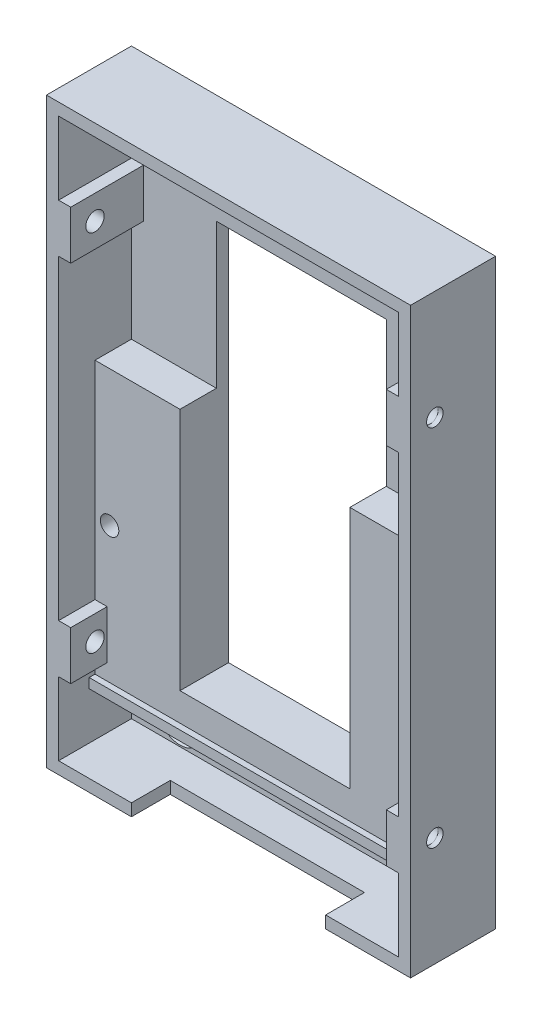
from build123d import *

# Parameters (mm, degrees)
SKICA1_W                                          = 75
SKICA1_H                                          = 120
SKICA1_W_2                                        = 35
SKICA1_H_2                                        = 80
P_IDAT_VYSUNUT_M1_DEPTH                           = 2.5
SKICA2_W                                          = 75
SKICA2_H                                          = 120
SKICA2_W_2                                        = 70
SKICA2_H_2                                        = 115
P_IDAT_VYSUNUT_M2_DEPTH                           = 15
KU_ELOV_ZAHLOUBEN_PRO_M4_ROUBU_SE_2_COUNT         = 2
KU_ELOV_ZAHLOUBEN_PRO_M4_ROUBU_SE_2_PITCH         = 50
KU_ELOV_ZAHLOUBEN_PRO_M4_ROUBU_SE_3_COUNT         = 2
KU_ELOV_ZAHLOUBEN_PRO_M4_ROUBU_SE_3_PITCH         = 105
KU_ELOV_ZAHLOUBEN_PRO_M4_ROUBU_SE_4_COUNT         = 2
KU_ELOV_ZAHLOUBEN_PRO_M4_ROUBU_SE_4_PITCH         = 116.297033496
ODEBRAT_VYSUNUT_M4_DEPTH                          = 10
P_IDAT_VYSUNUT_M3_DEPTH                           = 7.5
SKICA22_W                                         = 70
SKICA22_H                                         = 2
P_IDAT_VYSUNUT_M4_DEPTH                           = 1.2
D_RY_PRO_KOL_K_VELIKOST_MM1_D                     = 3.8
D_RY_PRO_KOL_K_VELIKOST_MM1_DEPTH                 = 7.5
D_RY_PRO_KOL_K_VELIKOST_MM1_TIP                   = 1.141635176
SKICA27_W                                         = 2.5
SKICA27_H                                         = 10
P_IDAT_VYSUNUT_M5_DEPTH                           = 15
V_LCOV_ZAHLOUBEN_PRO_M3_ROUBY_S_K_NIC_D           = 3.4
V_LCOV_ZAHLOUBEN_PRO_M3_ROUBY_S_K_NIC_DEPTH       = 5
V_LCOV_ZAHLOUBEN_PRO_M3_ROUBY_S_K_NIC_CBORE_D     = 3.8
V_LCOV_ZAHLOUBEN_PRO_M3_ROUBY_S_K_NIC_CBORE_DEPTH = 4


with BuildPart() as part:
    # Skica1 → Přidat vysunutím1 (new body)
    with BuildSketch(Plane.XY):
        Rectangle(SKICA1_W, SKICA1_H)
        Rectangle(SKICA1_W_2, SKICA1_H_2, mode=Mode.SUBTRACT)
    extrude(amount=P_IDAT_VYSUNUT_M1_DEPTH)

    # Skica2 → Přidat vysunutím2 (add)
    with BuildSketch(Plane.XY.offset(2.5)):
        Rectangle(SKICA2_W, SKICA2_H)
        Rectangle(SKICA2_W_2, SKICA2_H_2, mode=Mode.SUBTRACT)
    extrude(amount=P_IDAT_VYSUNUT_M2_DEPTH)

    # Skica15 → Kuželové zahloubení pro M4 šroubu se zápustnou hlavou plochou2 (revolve, cut)
    with BuildSketch(Plane(origin=(25, 52.5, 2.5), x_dir=(0, -1, 0), z_dir=(1, 0, 0))):
        Polygon((0, 0), (0, 2.5), (2.25, 2.5), (2.25, 2.45), (4.7, 0), align=None)
    ku_elov_zahlouben_pro_m4_roubu_se_z_p = revolve(axis=Axis((25, 52.5, 8.85), (0, 0, -1)), mode=Mode.SUBTRACT)

    # Ku_elov_ zahlouben_ pro M4 _roubu se 2: Kuželové zahloubení pro M4 šroubu se zápustnou hlavou plochou2 ×2
    with Locations(*[(-i * KU_ELOV_ZAHLOUBEN_PRO_M4_ROUBU_SE_2_PITCH, 0, 0) for i in range(1, KU_ELOV_ZAHLOUBEN_PRO_M4_ROUBU_SE_2_COUNT)]):
        add(ku_elov_zahlouben_pro_m4_roubu_se_z_p, mode=Mode.SUBTRACT)

    # Ku_elov_ zahlouben_ pro M4 _roubu se 3: Kuželové zahloubení pro M4 šroubu se zápustnou hlavou plochou2 ×2
    with Locations(*[(0, -i * KU_ELOV_ZAHLOUBEN_PRO_M4_ROUBU_SE_3_PITCH, 0) for i in range(1, KU_ELOV_ZAHLOUBEN_PRO_M4_ROUBU_SE_3_COUNT)]):
        add(ku_elov_zahlouben_pro_m4_roubu_se_z_p, mode=Mode.SUBTRACT)

    # Ku_elov_ zahlouben_ pro M4 _roubu se 4: Kuželové zahloubení pro M4 šroubu se zápustnou hlavou plochou2 ×2
    with Locations(*[Vector(-0.42993358039234786, -0.9028605188239304, 0) * (i * KU_ELOV_ZAHLOUBEN_PRO_M4_ROUBU_SE_4_PITCH) for i in range(1, KU_ELOV_ZAHLOUBEN_PRO_M4_ROUBU_SE_4_COUNT)]):
        add(ku_elov_zahlouben_pro_m4_roubu_se_z_p, mode=Mode.SUBTRACT)

    # Skica20 → Odebrat vysunutím4 (cut)
    with BuildSketch(Plane.XZ.offset(60)):
        Polygon((0, 9.5), (-20, 9.5), (-20, 17.5), (20, 17.5), (20, 9.5), align=None)
    extrude(amount=-ODEBRAT_VYSUNUT_M4_DEPTH, mode=Mode.SUBTRACT)

    # Skica21 → Přidat vysunutím3 (add)
    with BuildSketch(Plane.XY.offset(2.5)):
        Polygon((35, -47.8), (-35, -47.8), (-35, 10.2), (-17.5, 10.2), (-17.5, -40), (17.5, -40), (17.5, 10.2), (35, 10.2), align=None)
    extrude(amount=P_IDAT_VYSUNUT_M3_DEPTH)

    # Skica22 → Přidat vysunutím4 (add)
    with BuildSketch(Plane.XY.offset(10)):
        with Locations((0, -46.8)):
            Rectangle(SKICA22_W, SKICA22_H)
    extrude(amount=P_IDAT_VYSUNUT_M4_DEPTH)

    # Díry pro kolík, velikost mm1
    with Locations(Plane.XY.offset(10)):
        with Locations((32, -17.8), (-32, -17.8)):
            Hole(D_RY_PRO_KOL_K_VELIKOST_MM1_D / 2, depth=D_RY_PRO_KOL_K_VELIKOST_MM1_DEPTH)
            with Locations((0, 0, -(D_RY_PRO_KOL_K_VELIKOST_MM1_DEPTH + D_RY_PRO_KOL_K_VELIKOST_MM1_TIP / 2))):  # 118° drill point
                Cone(0, D_RY_PRO_KOL_K_VELIKOST_MM1_D / 2, D_RY_PRO_KOL_K_VELIKOST_MM1_TIP, mode=Mode.SUBTRACT)

    # Skica27 → Přidat vysunutím5 (add)
    with BuildSketch(Plane.XY.offset(2.5)):
        with Locations((33.75, 37.5)):
            Rectangle(SKICA27_W, SKICA27_H)
        with Locations((-33.75, 37.5)):
            Rectangle(SKICA27_W, SKICA27_H)
    p_idat_vysunut_m5 = extrude(amount=P_IDAT_VYSUNUT_M5_DEPTH)

    # Zrcadlit1: Přidat vysunutím5 across plane
    add(p_idat_vysunut_m5.mirror(Plane.ZX))

    # Válcové zahloubení pro M3 šrouby s kónickou hlavou1
    with Locations(Plane(origin=(-32.5, 0, 0), x_dir=(0, 0, -1), z_dir=(1, 0, 0))):
        with Locations((-12.5, -37.5), (-12.5, 37.5)):
            v_lcov_zahlouben_pro_m3_rouby_s_k_nic = CounterBoreHole(V_LCOV_ZAHLOUBEN_PRO_M3_ROUBY_S_K_NIC_D / 2, V_LCOV_ZAHLOUBEN_PRO_M3_ROUBY_S_K_NIC_CBORE_D / 2, V_LCOV_ZAHLOUBEN_PRO_M3_ROUBY_S_K_NIC_CBORE_DEPTH, depth=V_LCOV_ZAHLOUBEN_PRO_M3_ROUBY_S_K_NIC_DEPTH)

    # Zrcadlit2: Válcové zahloubení pro M3 šrouby s kónickou hlavou1 across plane
    add(v_lcov_zahlouben_pro_m3_rouby_s_k_nic.mirror(Plane(origin=(0, 0, 0), x_dir=(0, 0, 1), z_dir=(1, 0, 0))), mode=Mode.SUBTRACT)


solid = part.part
